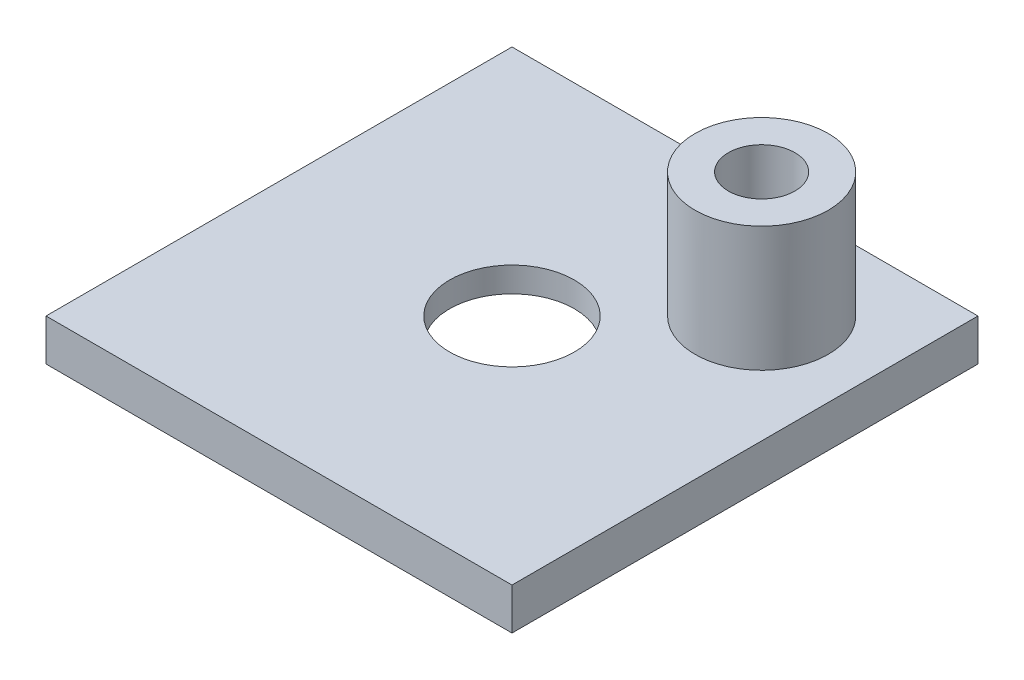
from build123d import *

# Parameters (mm, degrees)
SKETCH1_W               = 56
SKETCH1_H               = 56
BOSS_EXTRUDE1_DEPTH     = 5
SKETCH2_R               = 8
BOSS_EXTRUDE2_DEPTH     = 15
SKETCH4_R               = 19
CUT_EXTRUDE2_DEPTH      = 2
CUT_EXTRUDE3_DEPTH      = 44.497126342
CUT_EXTRUDE3_DEPTH_BACK = 44.497126342
SKETCH5_R               = 7.5
SKETCH6_R               = 4
CUT_EXTRUDE4_DEPTH      = 15


with BuildPart() as part:
    # Sketch1 → Boss-Extrude1 (new body)
    with BuildSketch(Plane(origin=(0, 0, 0), x_dir=(1, 0, 0), z_dir=(0, 1, 0))):
        Rectangle(SKETCH1_W, SKETCH1_H)
    extrude(amount=BOSS_EXTRUDE1_DEPTH)

    # Sketch2 → Boss-Extrude2 (add)
    with BuildSketch(Plane(origin=(0, 5, 0), x_dir=(1, 0, 0), z_dir=(0, 1, 0))):
        with Locations(Location((15, 15, 0), (0, 0, 90))):
            Circle(SKETCH2_R)
    extrude(amount=BOSS_EXTRUDE2_DEPTH)

    # Sketch4 → Cut-Extrude2 (cut)
    with BuildSketch(Plane.XZ):
        with Locations(Location((0, 0, 0), (0, 0, 270))):
            Circle(SKETCH4_R)
    extrude(amount=-CUT_EXTRUDE2_DEPTH, mode=Mode.SUBTRACT)

    # Sketch5 → Cut-Extrude3 (cut, two sides: drawn at the far end of the back side and taken through both)
    with BuildSketch(Plane.XZ.offset(-2).offset(-CUT_EXTRUDE3_DEPTH_BACK)):
        with Locations(Location((0, 0, 0), (0, 0, 270))):
            Circle(SKETCH5_R)
    extrude(amount=CUT_EXTRUDE3_DEPTH + CUT_EXTRUDE3_DEPTH_BACK, mode=Mode.SUBTRACT)

    # Sketch6 → Cut-Extrude4 (cut)
    with BuildSketch(Plane(origin=(0, 20, 0), x_dir=(1, 0, 0), z_dir=(0, 1, 0))):
        with Locations(Location((15, 15, 0), (0, 0, 270))):
            Circle(SKETCH6_R)
    extrude(amount=-CUT_EXTRUDE4_DEPTH, mode=Mode.SUBTRACT)


solid = part.part
